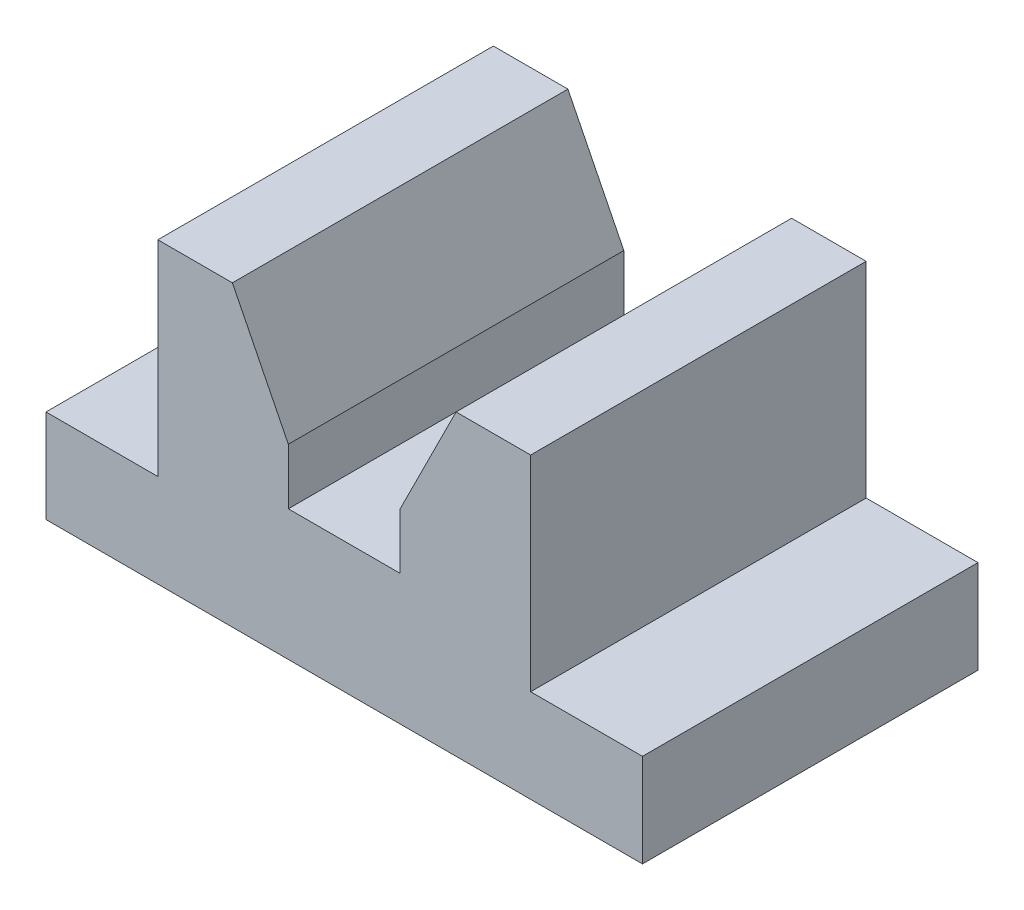
from build123d import *

# Parameters (mm, degrees)
EXTRUDE_1_DEPTH = 18


with BuildPart() as part:
    # 草图1 → 凸台-拉伸1 (new body)
    with BuildSketch(Plane.XY):
        Polygon((16, 0), (-16, 0), (-16, 5), (-10, 5), (-10, 16), (-6, 16), (-3, 10), (-3, 7), (3, 7), (3, 10), (6, 16), (10, 16), (10, 5), (16, 5), align=None)
    extrude(amount=EXTRUDE_1_DEPTH)


solid = part.part
